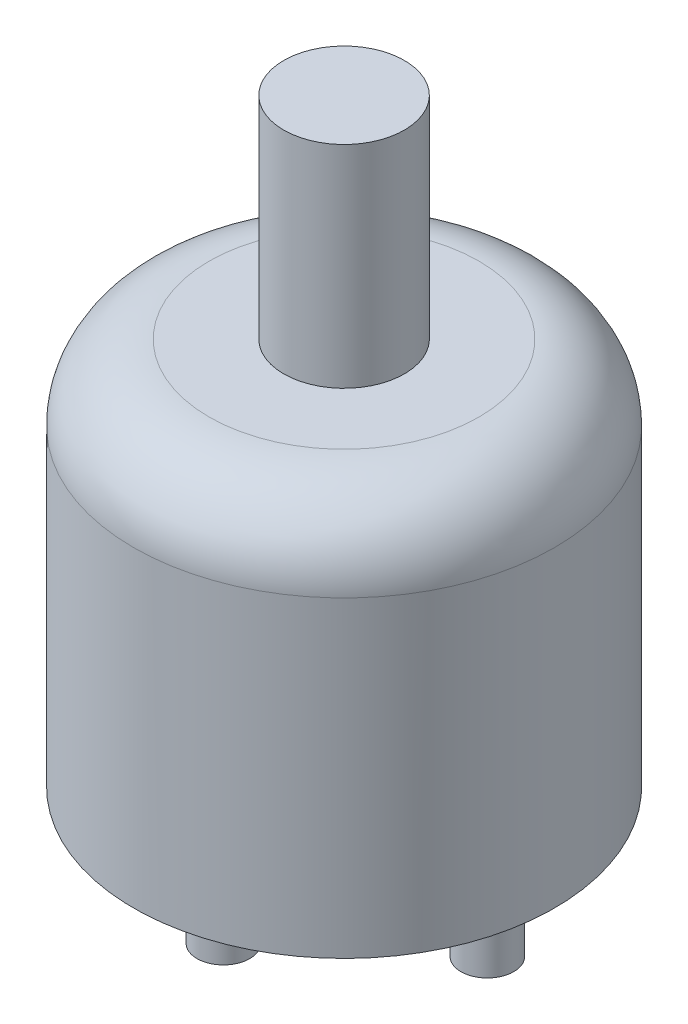
from build123d import *

# Parameters (mm, degrees)
SKETCH1_R           = 13.95
BOSS_EXTRUDE1_DEPTH = 25.7
FILLET1_R           = 5
SKETCH2_R           = 4
BOSS_EXTRUDE2_DEPTH = 14
BOSS_EXTRUDE3_DEPTH = 5


with BuildPart() as part:
    # Sketch1 → Boss-Extrude1 (new body)
    with BuildSketch(Plane(origin=(0, 0, 0), x_dir=(1, 0, 0), z_dir=(0, 1, 0))):
        with Locations(Location((0, 0, 0), (0, 0, 90))):
            Circle(SKETCH1_R)
    extrude(amount=BOSS_EXTRUDE1_DEPTH)

    # Fillet1
    fillet1_edges = [part.edges().sort_by_distance(p)[0] for p in [
        (0, 25.7, 13.95),
    ]]
    fillet(fillet1_edges, radius=FILLET1_R)

    # Sketch2 → Boss-Extrude2 (add)
    with BuildSketch(Plane(origin=(0, 25.7, 0), x_dir=(1, 0, 0), z_dir=(0, 1, 0))):
        with Locations(Location((0, 0, 0), (0, 0, 270))):
            Circle(SKETCH2_R)
    extrude(amount=BOSS_EXTRUDE2_DEPTH)

    # Sketch3 → Boss-Extrude3 (add)
    with BuildSketch(Plane.XZ):
        with BuildLine():
            ThreePointArc((0, 9.75), (-1.75, 8), (0, 6.25))
            Line((0, 6.25), (0, 9.75))
        make_face()
        with BuildLine():
            Line((0, 9.75), (0, 6.25))
            ThreePointArc((0, 6.25), (1.237436867, 6.762563133), (1.75, 8))
            ThreePointArc((1.75, 8), (1.237436867, 9.237436867), (0, 9.75))
        make_face()
        with BuildLine():
            ThreePointArc((-11.25, 0), (-9.5, -1.75), (-7.75, 0))
            Line((-7.75, 0), (-11.25, 0))
        make_face()
        with BuildLine():
            Line((-11.25, 0), (-7.75, 0))
            ThreePointArc((-7.75, 0), (-9.5, 1.75), (-11.25, 0))
        make_face()
        with BuildLine():
            ThreePointArc((1.75, -8), (1.237436867, -6.762563133), (0, -6.25))
            Line((0, -6.25), (0, -9.75))
            ThreePointArc((0, -9.75), (1.237436867, -9.237436867), (1.75, -8))
        make_face()
        with BuildLine():
            Line((0, -9.75), (0, -6.25))
            ThreePointArc((0, -6.25), (-1.75, -8), (0, -9.75))
        make_face()
        with BuildLine():
            ThreePointArc((7.75, 0), (9.5, -1.75), (11.25, 0))
            Line((11.25, 0), (7.75, 0))
        make_face()
        with BuildLine():
            Line((7.75, 0), (11.25, 0))
            ThreePointArc((11.25, 0), (9.5, 1.75), (7.75, 0))
        make_face()
    extrude(amount=BOSS_EXTRUDE3_DEPTH)


solid = part.part
